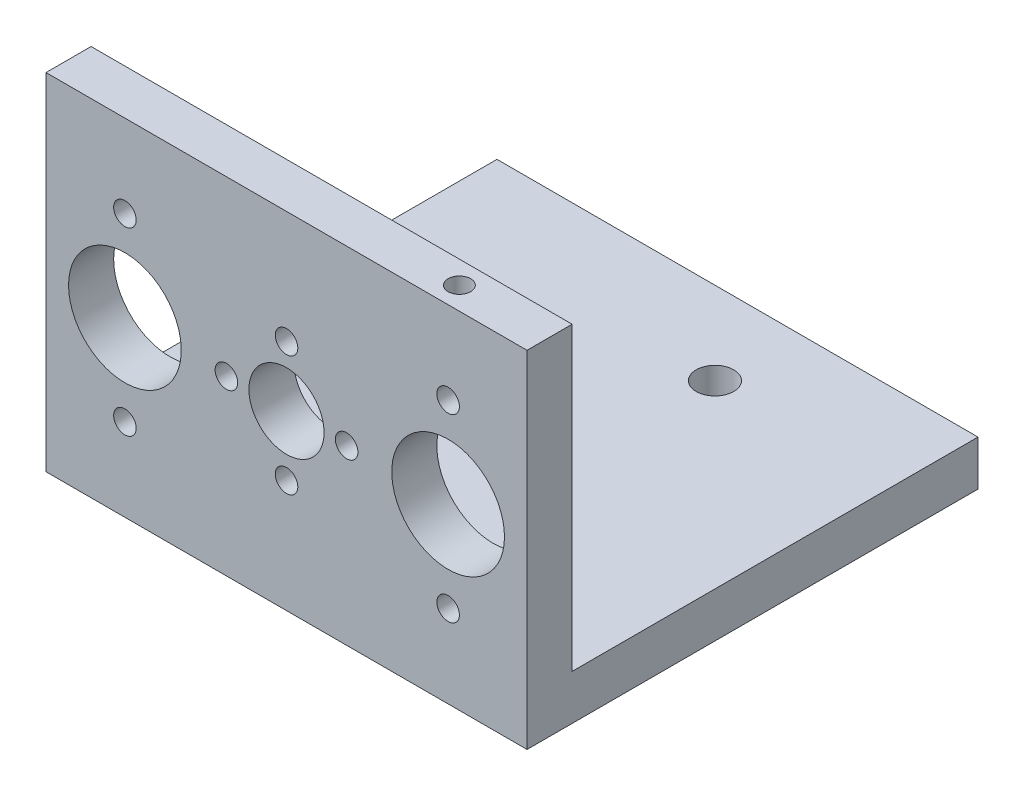
from build123d import *

# Parameters (mm, degrees)
EXTRUDE_1_DEPTH     = 104
SKETCH_2_R          = 2.5
CUT_EXTRUDE_1_DEPTH = 151.638640461
SKETCH_3_R          = 5
SKETCH_3_R_2        = 1.5
SKETCH_3_R_3        = 7.5
CUT_EXTRUDE_2_DEPTH = 142.887279204
SKETCH_4_R          = 1.5
CUT_EXTRUDE_3_DEPTH = 5


with BuildPart() as part:
    # 草图1 → 凸台-拉伸1 (new body)
    with BuildSketch(Plane(origin=(0, 0, 0), x_dir=(0, 0, -1), z_dir=(1, 0, 0))):
        Polygon((0, 0), (80, 0), (80, 6), (6, 6), (6, 80), (0, 80), (0, 6), align=None)
    extrude(amount=EXTRUDE_1_DEPTH)

    # 草图2 → 切除-拉伸1 (cut, through all)
    with BuildSketch(Plane(origin=(0, 6, 0), x_dir=(1, 0, 0), z_dir=(0, 1, 0))):
        with Locations(Location((60, 11, 0), (0, 0, 270))):
            Circle(SKETCH_2_R)
        with Locations(Location((60, 49, 0), (0, 0, 270))):
            Circle(SKETCH_2_R)
        Polygon((84, 60), (20, 60), (20, 6), (0, 6), (0, 80), (84, 80), (104, 80), (104, 6), (84, 6), align=None)
    extrude(amount=-CUT_EXTRUDE_1_DEPTH, mode=Mode.SUBTRACT)

    # 草图3 → 切除-拉伸2 (cut, through all)
    with BuildSketch(Plane(origin=(0, 0, -6), x_dir=(-1, 0, 0), z_dir=(0, 0, -1))):
        with Locations((-52, 23)):
            Circle(SKETCH_3_R)
        with Locations((-52, 15)):
            Circle(SKETCH_3_R_2)
        with Locations((-60, 23)):
            Circle(SKETCH_3_R_2)
        with Locations((-52, 31)):
            Circle(SKETCH_3_R_2)
        with Locations((-44, 23)):
            Circle(SKETCH_3_R_2)
        with Locations((-30.5, 23)):
            Circle(SKETCH_3_R_3)
        with Locations((-30.5, 35)):
            Circle(SKETCH_3_R_2)
        with Locations(Location((-30.5, 11, 0), (0, 0, 180))):
            Circle(SKETCH_3_R_2)
        with Locations((-73.5, 11)):
            Circle(SKETCH_3_R_2)
        with Locations(Location((-73.5, 23, 0), (0, 0, 180))):
            Circle(SKETCH_3_R_3)
        with Locations(Location((-73.5, 35, 0), (0, 0, 180))):
            Circle(SKETCH_3_R_2)
        Polygon((-84, 0), (-84, 46), (-20, 46), (-20, 0), (0, 0), (0, 80), (-104, 80), (-104, 0), align=None)
    extrude(amount=-CUT_EXTRUDE_2_DEPTH, mode=Mode.SUBTRACT)

    # 草图4 → 切除-拉伸3 (cut)
    with BuildSketch(Plane(origin=(0, 46, 0), x_dir=(1, 0, 0), z_dir=(0, 1, 0))):
        with Locations(Location((72, 3, 0), (0, 0, 270))):
            Circle(SKETCH_4_R)
    extrude(amount=-CUT_EXTRUDE_3_DEPTH, mode=Mode.SUBTRACT)


solid = part.part
